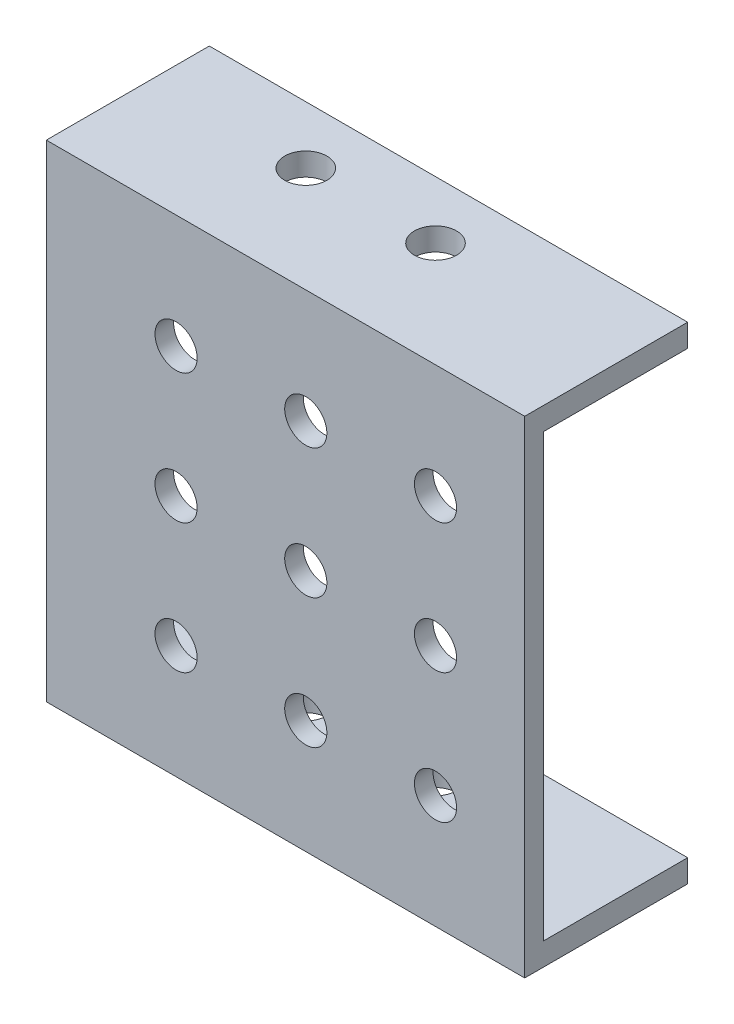
from build123d import *

# Parameters (mm, degrees)
SKETCH_1_W          = 295
SKETCH_1_H          = 300
SKETCH_1_R          = 13
EXTRUDE_516_DEPTH   = 11.5
SKETCH_2_W          = 295
SKETCH_2_H          = 14
EXTRUDE_1_DEPTH     = 89
SKETCH_3_R          = 13
CUT_EXTRUDE_1_DEPTH = 346.943998358


with BuildPart() as part:
    # 草图1 → Extrude 516 (new body)
    with BuildSketch(Plane.XY):
        with Locations((0, 150)):
            Rectangle(SKETCH_1_W, SKETCH_1_H)
        with Locations((92.5, 230)):
            Circle(SKETCH_1_R, mode=Mode.SUBTRACT)
        with Locations((92.5, 150)):
            Circle(SKETCH_1_R, mode=Mode.SUBTRACT)
        with Locations((92.5, 70)):
            Circle(SKETCH_1_R, mode=Mode.SUBTRACT)
        with Locations((12.5, 230)):
            Circle(SKETCH_1_R, mode=Mode.SUBTRACT)
        with Locations((-67.5, 230)):
            Circle(SKETCH_1_R, mode=Mode.SUBTRACT)
        with Locations((-67.5, 150)):
            Circle(SKETCH_1_R, mode=Mode.SUBTRACT)
        with Locations((-67.5, 70)):
            Circle(SKETCH_1_R, mode=Mode.SUBTRACT)
        with Locations((12.5, 70)):
            Circle(SKETCH_1_R, mode=Mode.SUBTRACT)
        with Locations((12.5, 150)):
            Circle(SKETCH_1_R, mode=Mode.SUBTRACT)
    extrude(amount=EXTRUDE_516_DEPTH)

    # 草图2 → 凸台-拉伸1 (add)
    with BuildSketch(Plane(origin=(0, 0, 0), x_dir=(-1, 0, 0), z_dir=(0, 0, -1))):
        with Locations((0, 293)):
            Rectangle(SKETCH_2_W, SKETCH_2_H)
        with Locations((0, 7)):
            Rectangle(SKETCH_2_W, SKETCH_2_H)
    extrude(amount=EXTRUDE_1_DEPTH)

    # 草图3 → 切除-拉伸1 (cut, through all)
    with BuildSketch(Plane(origin=(0, 300, 0), x_dir=(-1, 0, 0), z_dir=(0, 1, 0))):
        with Locations(Location((-27.5, -53.5, 0), (0, 0, 90))):
            Circle(SKETCH_3_R)
        with Locations(Location((52.5, -53.5, 0), (0, 0, 90))):
            Circle(SKETCH_3_R)
    extrude(amount=-CUT_EXTRUDE_1_DEPTH, mode=Mode.SUBTRACT)


solid = part.part
